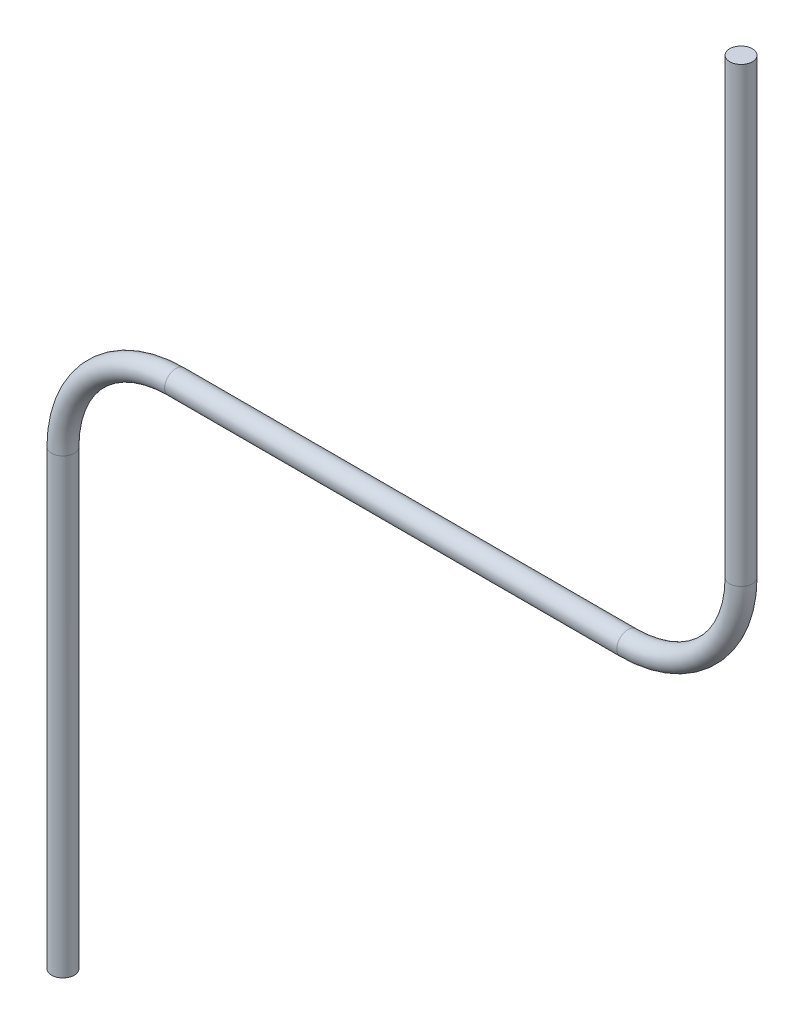
from build123d import *

# Parameters (mm, degrees)
SKETCH2_R = 2


with BuildPart() as part:
    # Sweep1: sweep along a path in Sketch1
    with BuildLine(Plane(origin=(0, 0, 0), x_dir=(1, 0, 0), z_dir=(0, 0, -1))) as sweep1_path:
        Line((0, 0), (0, 80))
        ThreePointArc((0, 80), (-5.857864376, 94.142135624), (-20, 100))
        Line((-20, 100), (-100, 100))
        ThreePointArc((-100, 100), (-114.142135624, 105.857864376), (-120, 120))
        Line((-120, 120), (-120, 200))
    # Sketch2 → Sweep1 (sweep)
    with BuildSketch(Plane(origin=(0, 0, 0), x_dir=(1, 0, 0), z_dir=(0, 1, 0))):
        Circle(SKETCH2_R)
    sweep(path=sweep1_path.line)


solid = part.part
